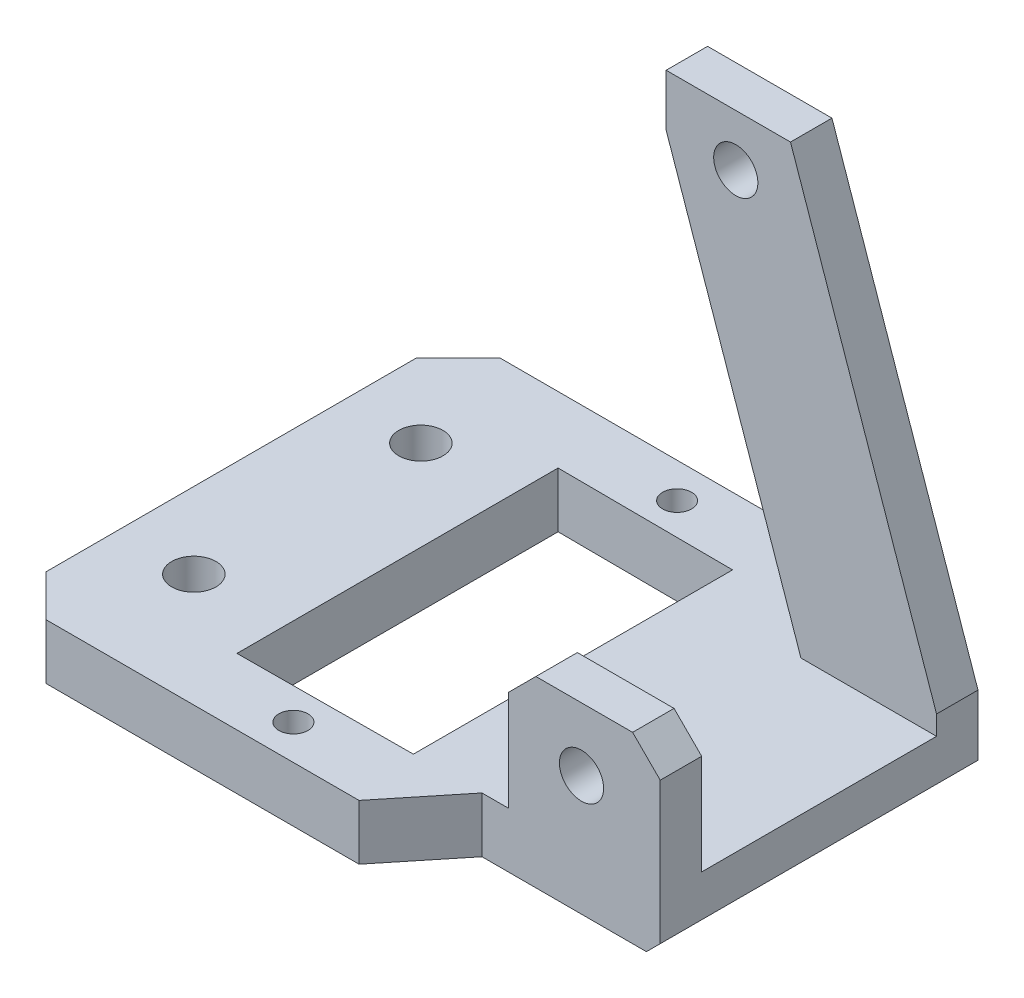
from build123d import *

# Parameters (mm, degrees)
BOSS_EXTRU_1_DEPTH      = 4
ESQUISSE4_W             = 11
ESQUISSE4_H             = 11
BOSS_EXTRU_2_DEPTH      = 3
BOSS_EXTRU_3_DEPTH      = 3
ESQUISSE6_R             = 1.6
ENL_V_MAT_EXTRU_1_DEPTH = 10
ESQUISSE7_R             = 1.6
ENL_V_MAT_EXTRU_2_DEPTH = 10
BOSS_EXTRU_4_DEPTH      = 4
ESQUISSE10_R            = 1.05
ESQUISSE10_R_2          = 1.6
ENL_V_MAT_EXTRU_3_DEPTH = 4
CHANFREIN1_SIZE         = 1
CHANFREIN2_SIZE         = 3
CHANFREIN3_SIZE         = 2


with BuildPart() as part:
    # Esquisse2 → Boss.-Extru.1 (new body)
    with BuildSketch(Plane(origin=(0, 0, 0), x_dir=(1, 0, 0), z_dir=(0, 1, 0))):
        Polygon((17.5, 0), (17.5, 11.5), (-17.5, 11.5), (-17.5, 0), (-17.5, -11.5), (17.5, -11.5), align=None)
    extrude(amount=BOSS_EXTRU_1_DEPTH)

    # Esquisse4 → Boss.-Extru.2 (add)
    with BuildSketch(Plane.XY.offset(11.5)):
        with Locations((12, 7.750794337)):
            Rectangle(ESQUISSE4_W, ESQUISSE4_H)
    extrude(amount=-BOSS_EXTRU_2_DEPTH)

    # Esquisse5 → Boss.-Extru.3 (add)
    with BuildSketch(Plane(origin=(0, 0, -11.5), x_dir=(-1, 0, 0), z_dir=(0, 0, -1))):
        Polygon((-17.5, 2.494257601), (-17.5, 5.399089221), (-6.928293138, 35.966080358), (2.072303922, 35.966080358), (2.072303922, 32.210427233), (-7.684376604, 4), (-7.684376604, 2.494257601), align=None)
    extrude(amount=-BOSS_EXTRU_3_DEPTH)

    # Esquisse6 → Enlèv. mat.-Extru.1 (cut)
    with BuildSketch(Plane.XY.offset(11.5)):
        with Locations((11.802703711, 8.683300858)):
            Circle(ESQUISSE6_R)
    extrude(amount=-ENL_V_MAT_EXTRU_1_DEPTH, mode=Mode.SUBTRACT)

    # Esquisse7 → Enlèv. mat.-Extru.2 (cut)
    with BuildSketch(Plane(origin=(0, 0, -11.5), x_dir=(-1, 0, 0), z_dir=(0, 0, -1))):
        with Locations((-2.967152129, 32.227121405)):
            Circle(ESQUISSE7_R)
    extrude(amount=-ENL_V_MAT_EXTRU_2_DEPTH, mode=Mode.SUBTRACT)

    # Esquisse8 → Boss.-Extru.4 (add)
    with BuildSketch(Plane.XZ):
        Polygon((4.598369828, -11.5), (0.61743287, -16.416755672), (-25.041628639, -16.416755672), (-25.041628639, 16.416755672), (0.61743287, 16.416755672), (4.598369828, 11.5), align=None)
    extrude(amount=-BOSS_EXTRU_4_DEPTH)

    # Esquisse10 → Enlèv. mat.-Extru.3 (cut)
    with BuildSketch(Plane(origin=(0, 4, 0), x_dir=(1, 0, 0), z_dir=(0, 1, 0))):
        with Locations(Location((-6.665623396, -13.88650623, 0), (0, 0, 270))):
            Circle(ESQUISSE10_R)
        with Locations(Location((-6.665623396, 13.88650623, 0), (0, 0, 270))):
            Circle(ESQUISSE10_R)
        with Locations(Location((-19.541628639, 8.216755672, 0), (0, 0, 270))):
            Circle(ESQUISSE10_R_2)
        with Locations(Location((-19.541628639, -8.216755672, 0), (0, 0, 270))):
            Circle(ESQUISSE10_R_2)
        Polygon((-13.015623396, -11.622936602), (-13.015623396, 11.622936602), (-0.315623396, 11.55), (-0.315623396, -11.55), align=None)
    extrude(amount=-ENL_V_MAT_EXTRU_3_DEPTH, mode=Mode.SUBTRACT)

    # Chanfrein1
    chanfrein1_edges = [part.edges().sort_by_distance(p)[0] for p in [
        (17.5, 0, 0),
    ]]
    chamfer(chanfrein1_edges, length=CHANFREIN1_SIZE)

    # Chanfrein2
    chanfrein2_edges = [part.edges().sort_by_distance(p)[0] for p in [
        (-25.041628639, 2, -16.416755672),
        (-25.041628639, 2, 16.416755672),
    ]]
    chamfer(chanfrein2_edges, length=CHANFREIN2_SIZE)

    # Chanfrein3
    chanfrein3_edges = [part.edges().sort_by_distance(p)[0] for p in [
        (6.5, 13.250794337, 10),
        (17.5, 13.250794337, 10),
    ]]
    chamfer(chanfrein3_edges, length=CHANFREIN3_SIZE)


solid = part.part
